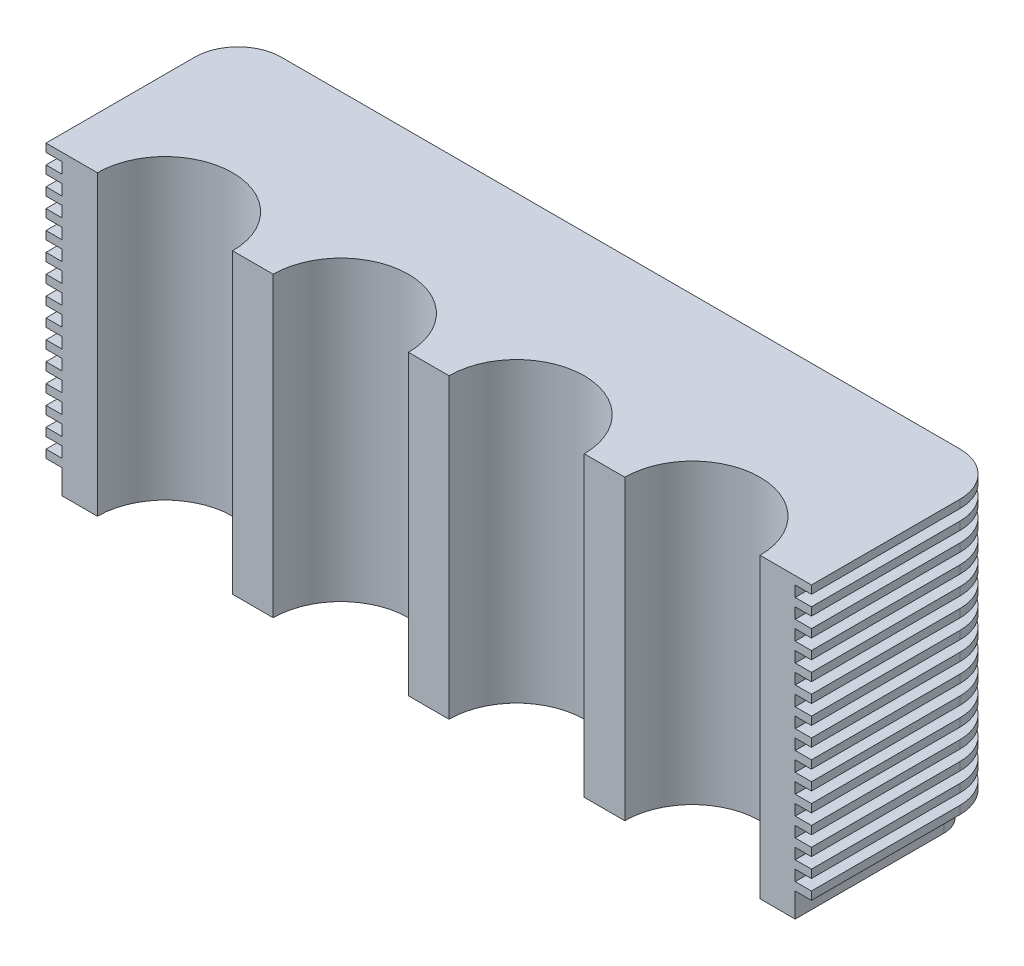
from build123d import *

# Parameters (mm, degrees)
BOSS_EXTRUDE1_DEPTH = 110
BOSS_EXTRUDE2_START = -3
BOSS_EXTRUDE2_DEPTH = 3
LPATTERN1_COUNT     = 15
LPATTERN1_PITCH     = 7


with BuildPart() as part:
    # Sketch1 → Boss-Extrude1 (new body)
    with BuildSketch(Plane(origin=(0, 0, 0), x_dir=(1, 0, 0), z_dir=(0, 1, 0))):
        with BuildLine():
            Line((0, 0), (13, 0))
            ThreePointArc((13, 0), (38, 25), (63, 0))
            Line((63, 0), (78, 0))
            ThreePointArc((78, 0), (103, 25), (128, 0))
            Line((128, 0), (143, 0))
            ThreePointArc((143, 0), (168, 25), (193, 0))
            Line((193, 0), (208, 0))
            ThreePointArc((208, 0), (233, 25), (258, 0))
            Line((258, 0), (271, 0))
            Line((271, 0), (271, 55))
            ThreePointArc((271, 55), (268.071067812, 62.071067812), (261, 65))
            Line((261, 65), (10, 65))
            ThreePointArc((10, 65), (2.928932188, 62.071067812), (0, 55))
            Line((0, 55), (0, 0))
        make_face()
    extrude(amount=BOSS_EXTRUDE1_DEPTH)

    # Sketch3 → Boss-Extrude2 (add)
    with BuildSketch(Plane(origin=(0, 110, 0), x_dir=(1, 0, 0), z_dir=(0, 1, 0)).offset(BOSS_EXTRUDE2_START)):
        with BuildLine():
            Line((277, 0), (277, 55))
            ThreePointArc((277, 55), (272.313708499, 66.313708499), (261, 71))
            Line((261, 71), (10, 71))
            ThreePointArc((10, 71), (-1.313708499, 66.313708499), (-6, 55))
            Line((-6, 55), (-6, 0))
            Line((-6, 0), (0, 0))
            Line((0, 0), (0, 55))
            ThreePointArc((0, 55), (2.928932188, 62.071067812), (10, 65))
            Line((10, 65), (261, 65))
            ThreePointArc((261, 65), (268.071067812, 62.071067812), (271, 55))
            Line((271, 55), (271, 0))
            Line((271, 0), (277, 0))
        make_face()
    boss_extrude2 = extrude(amount=BOSS_EXTRUDE2_DEPTH)

    # LPattern1: Boss-Extrude2 ×15
    with Locations(*[(0, -i * LPATTERN1_PITCH, 0) for i in range(1, LPATTERN1_COUNT)]):
        add(boss_extrude2)


solid = part.part
